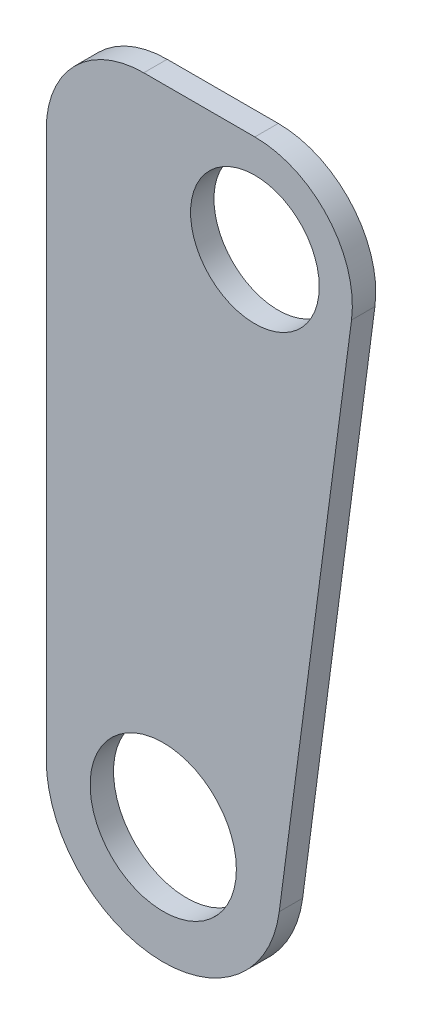
from build123d import *

# Parameters (mm, degrees)
SKETCH_1_R      = 37.5
SKETCH_1_R_2    = 33
EXTRUDE_1_DEPTH = 12
FILLET_1_R      = 50


with BuildPart() as part:
    # 草图1 → 凸台-拉伸1 (new body)
    with BuildSketch(Plane.XY):
        with BuildLine():
            Line((-60, 0), (-60, 330))
            Line((-60, 330), (104, 330))
            Line((104, 330), (59.485849651, -7.837964739))
            ThreePointArc((59.485849651, -7.837964739), (-3.927405054, -59.871324435), (-60, 0))
        make_face()
        Circle(SKETCH_1_R, mode=Mode.SUBTRACT)
        with Locations((47, 280)):
            Circle(SKETCH_1_R_2, mode=Mode.SUBTRACT)
    extrude(amount=EXTRUDE_1_DEPTH)

    # 圆角1
    fillet_1_edges = [part.edges().sort_by_distance(p)[0] for p in [
        (-60, 330, 6),
        (104, 330, 6),
    ]]
    fillet(fillet_1_edges, radius=FILLET_1_R)


solid = part.part
